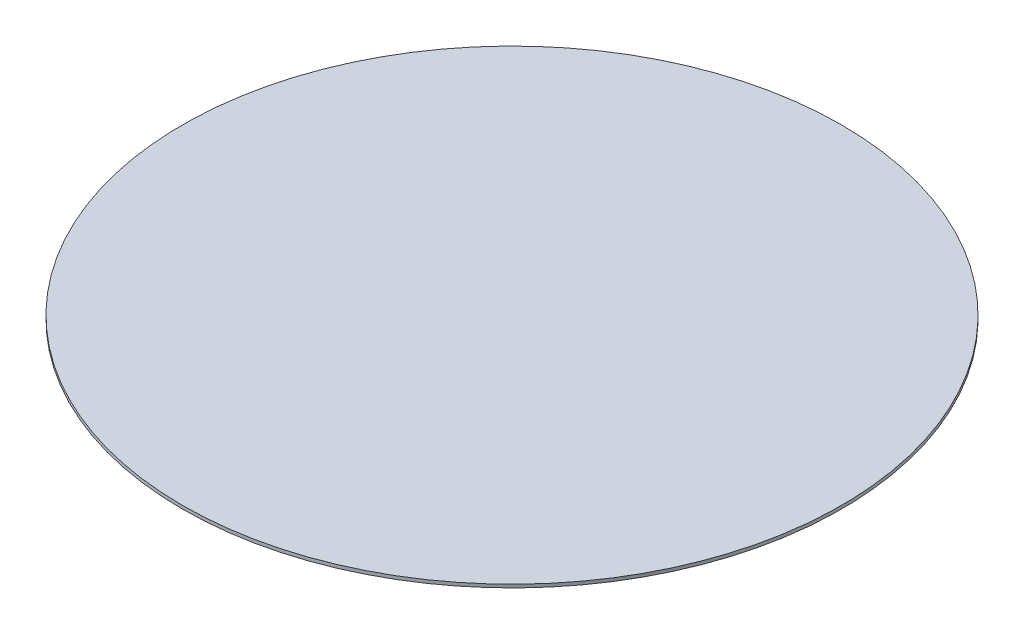
from build123d import *

# Parameters (mm, degrees)
SKETCH2_R           = 609.6
BOSS_EXTRUDE1_DEPTH = 6


with BuildPart() as part:
    # Sketch2 → Boss-Extrude1 (new body)
    with BuildSketch(Plane(origin=(0, 0, 0), x_dir=(1, 0, 0), z_dir=(0, 1, 0))):
        with Locations(Location((0, 0, 0), (0, 0, 270))):
            Circle(SKETCH2_R)
    extrude(amount=BOSS_EXTRUDE1_DEPTH)


solid = part.part
